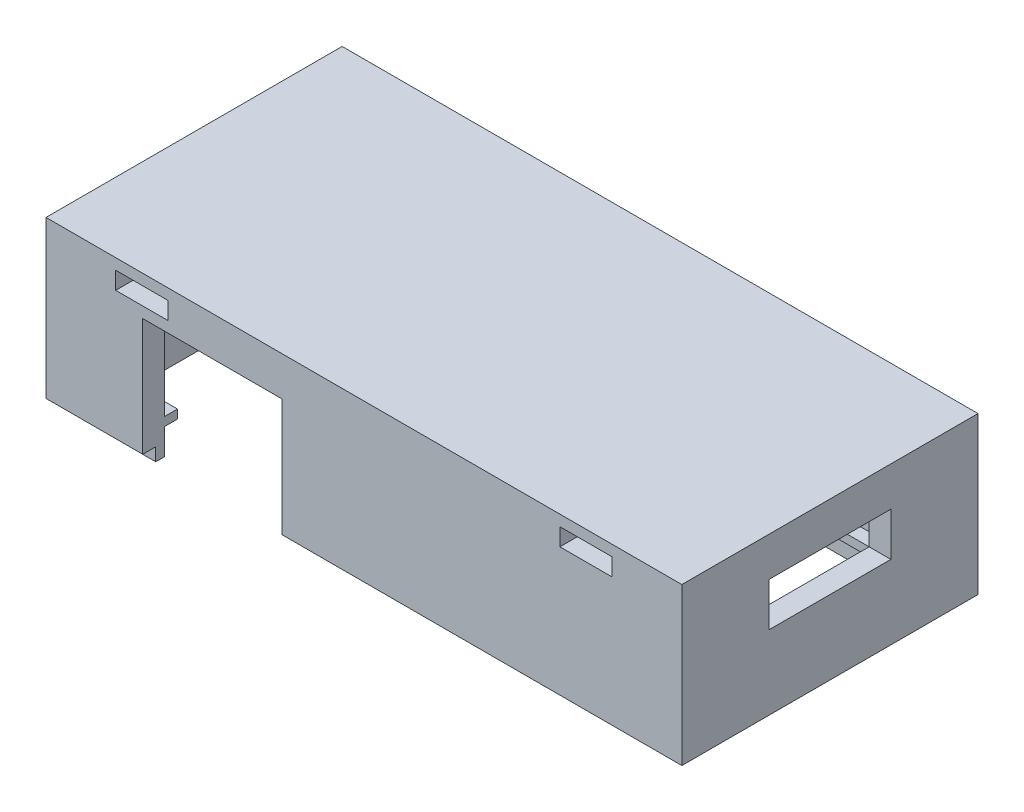
from build123d import *

# Parameters (mm, degrees)
SKETCH1_W             = 73
SKETCH1_H             = 34
BASE_DEPTH            = 4.5
SKETCH21_W            = 73
SKETCH21_H            = 34
EXTRUDE_UP_DEPTH      = 13.5
SKETCH22_W            = 68
SKETCH22_H            = 29
CUT_DOWN_DEPTH        = 13.5
SKETCH27_R            = 2
BOSS_EXTRUDE15_DEPTH  = 1.5
SKETCH29_R            = 2
BOSS_EXTRUDE16_DEPTH  = 1.5
SKETCH30_R            = 2
BOSS_EXTRUDE17_DEPTH  = 1.5
SKETCH28_R            = 2
BOSS_EXTRUDE18_DEPTH  = 1.5
SKETCH31_R            = 1.5
BOSS_EXTRUDE19_DEPTH  = 2
SKETCH32_R            = 1.5
BOSS_EXTRUDE20_DEPTH  = 2
SKETCH33_R            = 1.5
BOSS_EXTRUDE21_DEPTH  = 2
SKETCH34_R            = 1.5
BOSS_EXTRUDE22_DEPTH  = 2
SKETCH39_W            = 19
SKETCH39_H            = 1.3
WALL_SLIT_DEPTH       = 1.5
SKETCH41_W            = 2.5
SKETCH41_H            = 24
OUTSIDE_BLOCK_DEPTH   = 5
SKETCH44_W            = 2.5
SKETCH44_H            = 24
INSIDE_BLOCK_DEPTH    = 5
SKETCH62_W            = 70
SKETCH62_H            = 31
RAISE_LIP_DEPTH       = 1.5
SKETCH74_W            = 16
SKETCH74_H            = 15
USB_HOLE_DEPTH        = 2.5
SKETCH63_W            = 68
SKETCH63_H            = 29
CUT_LIP_DEPTH         = 1.5
SKETCH47_W            = 6
SKETCH47_H            = 2
TOP_TIE_HOLE_DEPTH    = 34
SKETCH48_W            = 6
SKETCH48_H            = 2
BOTTOM_TIE_HOLE_DEPTH = 34
SKETCH56_W            = 14
SKETCH56_H            = 5
WIRE_HOLE_DEPTH       = 2.5
SKETCH68_W            = 68
SKETCH68_H            = 1
RIGHT_LEDGE_DEPTH     = 1.5
SKETCH67_W            = 43.4
SKETCH67_H            = 1
SKETCH67_W_2          = 8.6
LEFT_LEDGE_DEPTH      = 1.5
SKETCH69_W            = 11
SKETCH69_H            = 6
SWITCH_HOLE_DEPTH     = 2.5
SKETCH70_W            = 7.245173121
SKETCH70_H            = 6
POWER_HOLE_DEPTH      = 2.5


with BuildPart() as part:
    # Sketch1 → base (new body)
    with BuildSketch(Plane(origin=(0, 0, 0), x_dir=(1, 0, 0), z_dir=(0, 1, 0))):
        with Locations((5.291578947, 0.823157895)):
            Rectangle(SKETCH1_W, SKETCH1_H)
    extrude(amount=BASE_DEPTH)

    # Sketch21 → extrude up (add)
    with BuildSketch(Plane(origin=(0, 0, 0), x_dir=(-1, 0, 0), z_dir=(0, -1, 0))):
        with Locations((-5.291578947, 0.823157895)):
            Rectangle(SKETCH21_W, SKETCH21_H)
    extrude(amount=EXTRUDE_UP_DEPTH)

    # Sketch22 → cut down (cut)
    with BuildSketch(Plane(origin=(0, -13.5, 0), x_dir=(-1, 0, 0), z_dir=(0, -1, 0))):
        with Locations((-5.291578947, 0.823157895)):
            Rectangle(SKETCH22_W, SKETCH22_H)
    extrude(amount=-CUT_DOWN_DEPTH, mode=Mode.SUBTRACT)

    # Sketch27 → Boss-Extrude15 (add)
    with BuildSketch(Plane.XZ):
        with Locations(Location((31.141578947, -11.923157895, 0), (0, 0, 270))):
            Circle(SKETCH27_R)
    extrude(amount=BOSS_EXTRUDE15_DEPTH)

    # Sketch29 → Boss-Extrude16 (add)
    with BuildSketch(Plane.XZ):
        with Locations(Location((9.041578947, -11.923157895, 0), (0, 0, 270))):
            Circle(SKETCH29_R)
    extrude(amount=BOSS_EXTRUDE16_DEPTH)

    # Sketch30 → Boss-Extrude17 (add)
    with BuildSketch(Plane.XZ):
        with Locations(Location((9.041578947, 10.276842105, 0), (0, 0, 270))):
            Circle(SKETCH30_R)
    extrude(amount=BOSS_EXTRUDE17_DEPTH)

    # Sketch28 → Boss-Extrude18 (add)
    with BuildSketch(Plane.XZ):
        with Locations(Location((31.141578947, 10.276842105, 0), (0, 0, 270))):
            Circle(SKETCH28_R)
    extrude(amount=BOSS_EXTRUDE18_DEPTH)

    # Sketch31 → Boss-Extrude19 (add)
    with BuildSketch(Plane.XZ.offset(1.5)):
        with Locations(Location((31.141578947, -11.923157895, 0), (0, 0, 270))):
            Circle(SKETCH31_R)
    extrude(amount=BOSS_EXTRUDE19_DEPTH)

    # Sketch32 → Boss-Extrude20 (add)
    with BuildSketch(Plane.XZ.offset(1.5)):
        with Locations(Location((9.041578947, -11.923157895, 0), (0, 0, 270))):
            Circle(SKETCH32_R)
    extrude(amount=BOSS_EXTRUDE20_DEPTH)

    # Sketch33 → Boss-Extrude21 (add)
    with BuildSketch(Plane.XZ.offset(1.5)):
        with Locations(Location((9.041578947, 10.276842105, 0), (0, 0, 270))):
            Circle(SKETCH33_R)
    extrude(amount=BOSS_EXTRUDE21_DEPTH)

    # Sketch34 → Boss-Extrude22 (add)
    with BuildSketch(Plane.XZ.offset(1.5)):
        with Locations(Location((31.141578947, 10.276842105, 0), (0, 0, 270))):
            Circle(SKETCH34_R)
    extrude(amount=BOSS_EXTRUDE22_DEPTH)

    # Sketch39 → wall slit (cut)
    with BuildSketch(Plane.XY.offset(-15.323157895)):
        with Locations((-11.708421053, -4.85)):
            Rectangle(SKETCH39_W, SKETCH39_H)
    extrude(amount=-WALL_SLIT_DEPTH, mode=Mode.SUBTRACT)

    # Sketch41 → outside block (add)
    with BuildSketch(Plane.XZ):
        with Locations((-27.458421053, -0.823157895)):
            Rectangle(SKETCH41_W, SKETCH41_H)
    extrude(amount=OUTSIDE_BLOCK_DEPTH)

    # Sketch44 → inside block (add)
    with BuildSketch(Plane.XZ):
        with Locations((4.041578947, -0.823157895)):
            Rectangle(SKETCH44_W, SKETCH44_H)
    extrude(amount=INSIDE_BLOCK_DEPTH)

    # Sketch62 → raise lip (add)
    with BuildSketch(Plane.XZ.offset(13.5)):
        with Locations((5.291578947, -0.823157895)):
            Rectangle(SKETCH62_W, SKETCH62_H)
    extrude(amount=RAISE_LIP_DEPTH)

    # Sketch74 → usb hole (cut)
    with BuildSketch(Plane(origin=(0, 0, 13.676842105), x_dir=(-1, 0, 0), z_dir=(0, 0, -1))):
        with Locations((12.108421053, -7.5)):
            Rectangle(SKETCH74_W, SKETCH74_H)
    extrude(amount=-USB_HOLE_DEPTH, mode=Mode.SUBTRACT)

    # Sketch63 → cut lip (cut)
    with BuildSketch(Plane.XZ.offset(15)):
        with Locations((5.291578947, -0.823157895)):
            Rectangle(SKETCH63_W, SKETCH63_H)
    extrude(amount=-CUT_LIP_DEPTH, mode=Mode.SUBTRACT)

    # Sketch47 → top tie hole (cut)
    with BuildSketch(Plane.XY.offset(16.176842105)):
        with Locations((30.791578947, 2.25)):
            Rectangle(SKETCH47_W, SKETCH47_H)
    extrude(amount=-TOP_TIE_HOLE_DEPTH, mode=Mode.SUBTRACT)

    # Sketch48 → bottom tie hole (cut)
    with BuildSketch(Plane.XY.offset(16.176842105)):
        with Locations((-20.208421053, 2.25)):
            Rectangle(SKETCH48_W, SKETCH48_H)
    extrude(amount=-BOTTOM_TIE_HOLE_DEPTH, mode=Mode.SUBTRACT)

    # Sketch56 → wire hole (cut)
    with BuildSketch(Plane.ZY.offset(-39.291578947)):
        with Locations((-0.823157895, -2.5)):
            Rectangle(SKETCH56_W, SKETCH56_H)
    extrude(amount=-WIRE_HOLE_DEPTH, mode=Mode.SUBTRACT)

    # Sketch68 → right ledge (add)
    with BuildSketch(Plane.XY.offset(-15.323157895)):
        with Locations((5.291578947, -11.5)):
            Rectangle(SKETCH68_W, SKETCH68_H)
    extrude(amount=RIGHT_LEDGE_DEPTH)

    # Sketch67 → left ledge (add)
    with BuildSketch(Plane(origin=(0, 0, 13.676842105), x_dir=(-1, 0, 0), z_dir=(0, 0, -1))):
        with Locations((-17.591578947, -11.5)):
            Rectangle(SKETCH67_W, SKETCH67_H)
        with Locations((24.408421053, -11.5)):
            Rectangle(SKETCH67_W_2, SKETCH67_H)
    extrude(amount=LEFT_LEDGE_DEPTH)

    # Sketch69 → switch hole (cut)
    with BuildSketch(Plane.XY.offset(-15.323157895)):
        with Locations((28.791578947, -7)):
            Rectangle(SKETCH69_W, SKETCH69_H)
    extrude(amount=-SWITCH_HOLE_DEPTH, mode=Mode.SUBTRACT)

    # Sketch70 → power hole (cut)
    with BuildSketch(Plane(origin=(0, 0, -17.823157895), x_dir=(-1, 0, 0), z_dir=(0, 0, -1))):
        with Locations((-9.668992387, -7)):
            Rectangle(SKETCH70_W, SKETCH70_H)
    extrude(amount=-POWER_HOLE_DEPTH, mode=Mode.SUBTRACT)


solid = part.part
